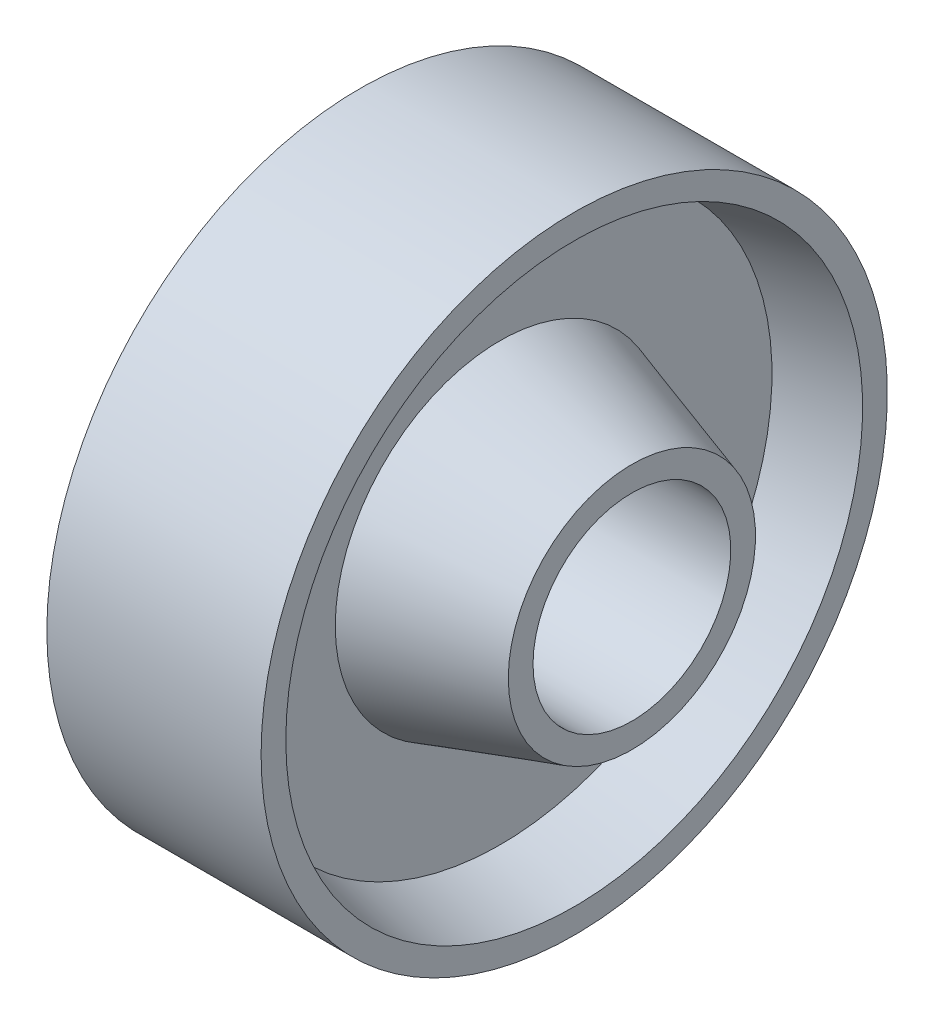
from build123d import *


with BuildPart() as part:
    # Sketch1 → Revolve1 (revolve)
    with BuildSketch(Plane.XY, mode=Mode.PRIVATE) as revolve1_sk:
        Polygon((0, 12), (40, 12), (40, 15), (24, 20), (24, 33), (33, 35), (33, 38), (7, 38), (7, 35), (16, 33), (16, 20), (0, 15), align=None)
    revolve(revolve1_sk.sketch.rotate(Axis((0, 0, 0), (1, 0, 0)), 90), axis=Axis((0, 0, 0), (1, 0, 0)))


solid = part.part
